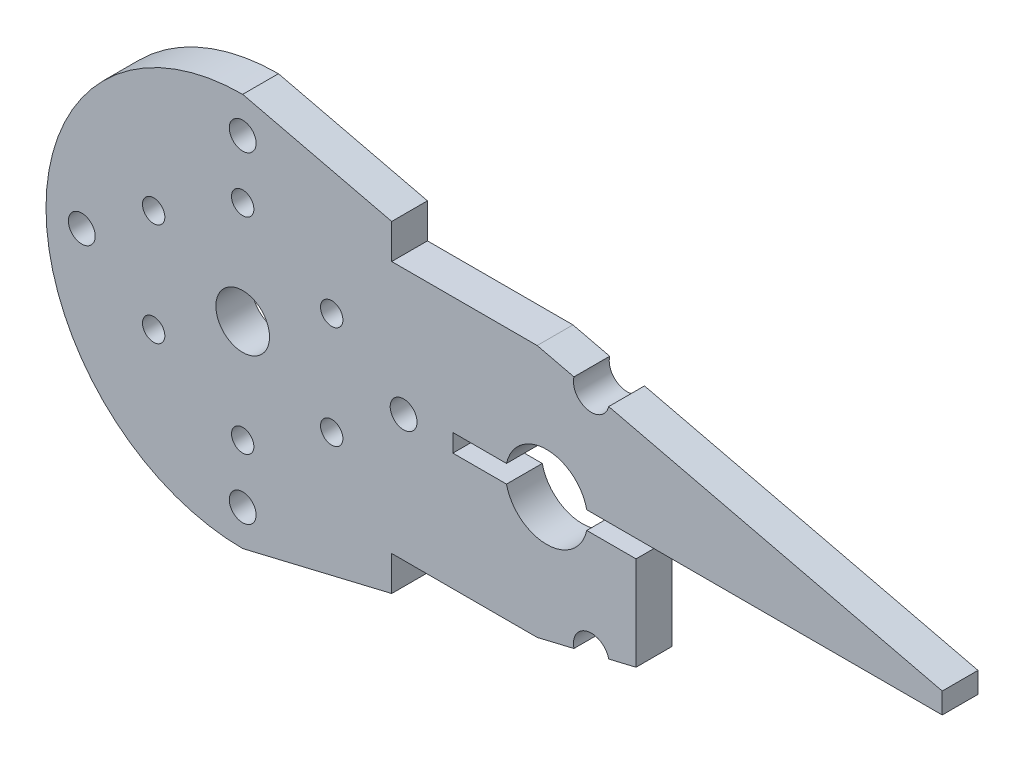
from build123d import *

# Parameters (mm, degrees)
SKETCH_1_R          = 3
SKETCH_1_R_2        = 1.25
SKETCH_1_R_3        = 1.5
EXTRUDE_1_DEPTH     = 4
SKETCH_2_R          = 2
SKETCH_2_W          = 18.21777686
SKETCH_2_H          = 14.090430323
CUT_EXTRUDE_1_DEPTH = 4


with BuildPart() as part:
    # 草图1 → 凸台-拉伸1 (new body)
    with BuildSketch(Plane.XY):
        with BuildLine():
            Line((-15.488984032, 1), (-9.488984032, 1))
            ThreePointArc((-9.488984032, 1), (-4.998995168, 4.6), (-0.509006304, 1))
            Line((-0.509006304, 1), (5.001004832, 1))
            Line((5.001004832, 1), (39.254812875, 1))
            Line((39.254812875, 1), (39.254812875, 3.326018382))
            Line((39.254812875, 3.326018382), (5.001004832, 11.501004832))
            Line((5.001004832, 11.501004832), (-38.998995168, 22.002009663))
            ThreePointArc((-38.998995168, 22.002009663), (-61.001004832, 0), (-38.998995168, -22.002009663))
            Line((-38.998995168, -22.002009663), (5.001004832, -11.501004832))
            Line((5.001004832, -11.501004832), (5.001004832, -1))
            Line((5.001004832, -1), (-0.509006304, -1))
            ThreePointArc((-0.509006304, -1), (-4.998995168, -4.6), (-9.488984032, -1))
            Line((-9.488984032, -1), (-15.488984032, -1))
            Line((-15.488984032, -1), (-15.488984032, 1))
        make_face()
        with Locations((-38.998995168, 0)):
            Circle(SKETCH_1_R, mode=Mode.SUBTRACT)
        with Locations((-38.998995168, -11.5)):
            Circle(SKETCH_1_R_2, mode=Mode.SUBTRACT)
        with Locations((-48.958287312, -5.75)):
            Circle(SKETCH_1_R_2, mode=Mode.SUBTRACT)
        with Locations((-48.958287312, 5.75)):
            Circle(SKETCH_1_R_2, mode=Mode.SUBTRACT)
        with Locations((-38.998995168, 11.5)):
            Circle(SKETCH_1_R_2, mode=Mode.SUBTRACT)
        with Locations((-29.039703025, 5.75)):
            Circle(SKETCH_1_R_2, mode=Mode.SUBTRACT)
        with Locations((-29.039703025, -5.75)):
            Circle(SKETCH_1_R_2, mode=Mode.SUBTRACT)
        with Locations((-38.998995168, -18.002009663)):
            Circle(SKETCH_1_R_3, mode=Mode.SUBTRACT)
        with Locations((-38.998995168, 18.002009663)):
            Circle(SKETCH_1_R_3, mode=Mode.SUBTRACT)
        with Locations((-57.001004832, 0)):
            Circle(SKETCH_1_R_3, mode=Mode.SUBTRACT)
        with Locations((-20.996985505, 0)):
            Circle(SKETCH_1_R_3, mode=Mode.SUBTRACT)
    extrude(amount=EXTRUDE_1_DEPTH)

    # 草图2 → 切除-拉伸1 (cut)
    with BuildSketch(Plane(origin=(0, 0, 0), x_dir=(-1, 0, 0), z_dir=(0, 0, -1))):
        with Locations((0, 12.694540648)):
            Circle(SKETCH_2_R)
        with Locations((0, -12.694540648)):
            Circle(SKETCH_2_R)
        with Locations((13.221008307, 21.185215162)):
            Rectangle(SKETCH_2_W, SKETCH_2_H)
        with Locations((13.221008307, -21.185215162)):
            Rectangle(SKETCH_2_W, SKETCH_2_H)
    extrude(amount=-CUT_EXTRUDE_1_DEPTH, mode=Mode.SUBTRACT)


solid = part.part
